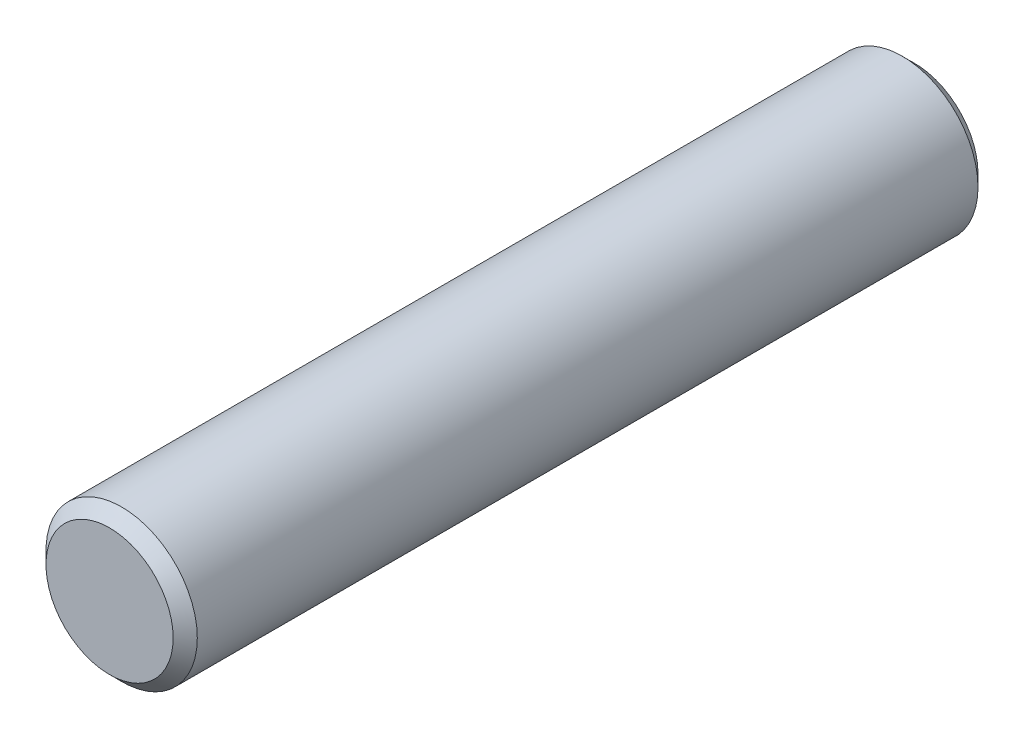
from build123d import *

# Parameters (mm, degrees)
SKETCH1_R      = 2.3876
EXTRUDE1_DEPTH = 12.7
CHAMFER1_SIZE  = 0.381


with BuildPart() as part:
    # Sketch1 → Extrude1 (new, symmetric)
    with BuildSketch(Plane.XY):
        Circle(SKETCH1_R)
    extrude(amount=EXTRUDE1_DEPTH, both=True)

    # Chamfer1
    chamfer1_edges = [part.edges().sort_by_distance(p)[0] for p in [
        (-2.3876, 0, -12.7),
        (-2.3876, 0, 12.7),
    ]]
    chamfer(chamfer1_edges, length=CHAMFER1_SIZE)


solid = part.part
